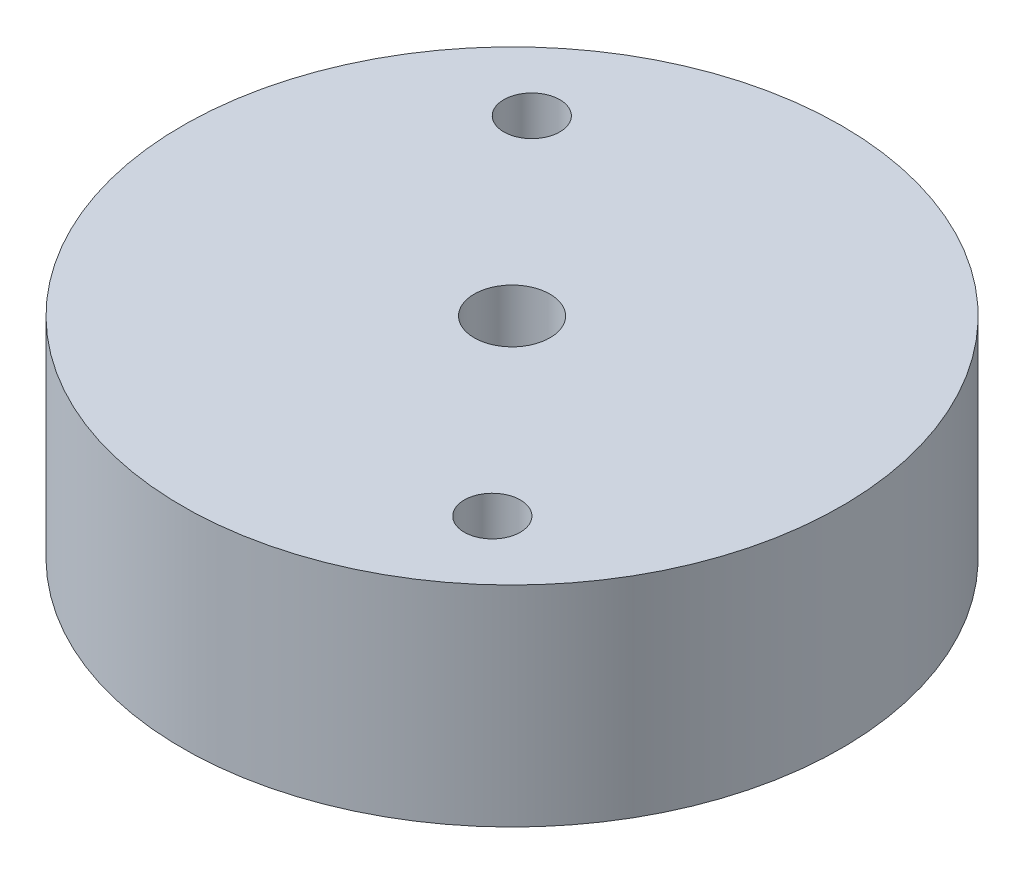
from build123d import *

# Parameters (mm, degrees)
SKETCH1_R           = 10
BOSS_EXTRUDE1_DEPTH = 6.36
SKETCH2_R           = 1.15
CUT_EXTRUDE1_DEPTH  = 6.36
CUT_EXTRUDE2_REACH  = 17.506
SKETCH3_R           = 0.85
CUT_EXTRUDE3_REACH  = 17.506
SKETCH4_R           = 0.85


with BuildPart() as part:
    # Sketch1 → Boss-Extrude1 (new body)
    with BuildSketch(Plane(origin=(0, 0, 0), x_dir=(1, 0, 0), z_dir=(0, 1, 0))):
        with Locations(Location((0, 0, 0), (0, 0, 90))):
            Circle(SKETCH1_R)
    extrude(amount=BOSS_EXTRUDE1_DEPTH)

    # Sketch2 → Cut-Extrude1 (cut)
    with BuildSketch(Plane(origin=(0, 6.36, 0), x_dir=(1, 0, 0), z_dir=(0, 1, 0))):
        with Locations(Location((0, 0, 0), (0, 0, 270))):
            Circle(SKETCH2_R)
    extrude(amount=-CUT_EXTRUDE1_DEPTH, mode=Mode.SUBTRACT)

    # Sketch3 → Cut-Extrude2 (cut, up to next)
    with BuildSketch(Plane(origin=(0, 6.36, 0), x_dir=(1, 0, 0), z_dir=(0, 1, 0)), mode=Mode.PRIVATE) as cut_extrude2_sk1:
        with Locations(Location((4.959818651, -5.559019603, 0), (0, 0, 270))):
            Circle(SKETCH3_R)
    cut_extrude2_tool1 = extrude(cut_extrude2_sk1.sketch, amount=-CUT_EXTRUDE2_REACH, mode=Mode.PRIVATE) & part.part
    add(cut_extrude2_tool1.solids().sort_by_distance((4.959819, 6.36, 5.55902))[0], mode=Mode.SUBTRACT)

    # Sketch4 → Cut-Extrude3 (cut, up to next)
    with BuildSketch(Plane(origin=(0, 6.36, 0), x_dir=(1, 0, 0), z_dir=(0, 1, 0)), mode=Mode.PRIVATE) as cut_extrude3_sk1:
        with Locations(Location((-4.959818651, 5.559019603, 0), (0, 0, 270))):
            Circle(SKETCH4_R)
    cut_extrude3_tool1 = extrude(cut_extrude3_sk1.sketch, amount=-CUT_EXTRUDE3_REACH, mode=Mode.PRIVATE) & part.part
    add(cut_extrude3_tool1.solids().sort_by_distance((-4.959819, 6.36, -5.55902))[0], mode=Mode.SUBTRACT)


solid = part.part
